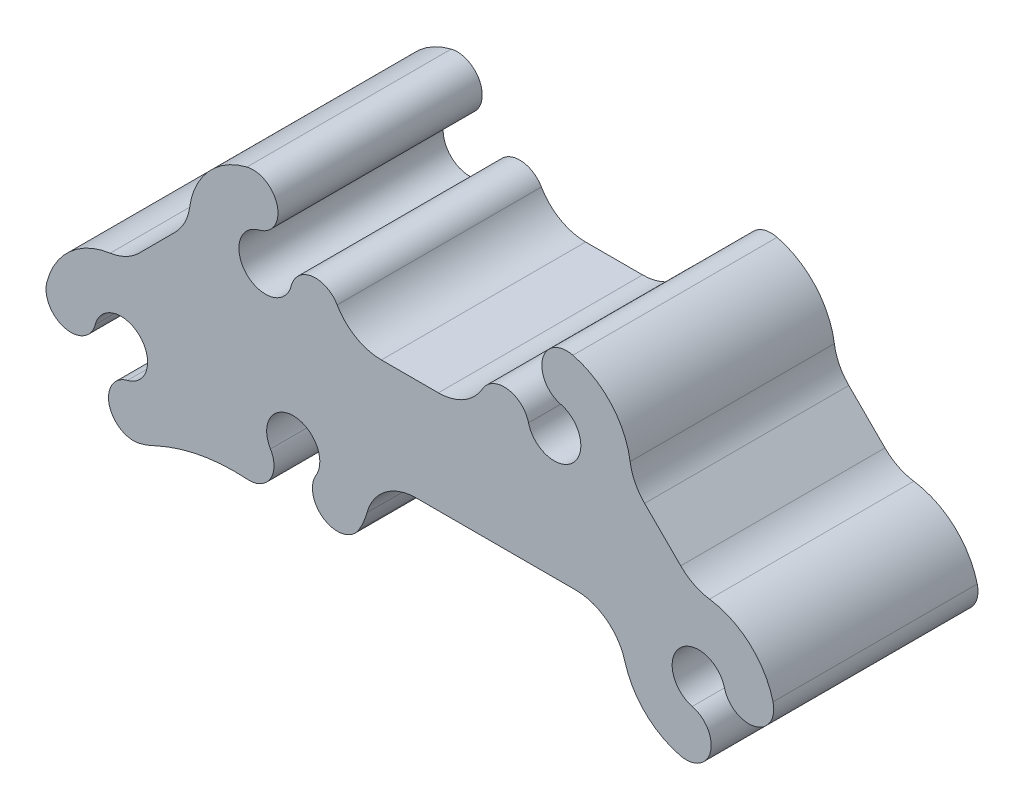
from build123d import *

# Parameters (mm, degrees)
BOSS_EXTRUDE1_DEPTH = 12.7


with BuildPart() as part:
    # Sketch1 → Boss-Extrude1 (new, symmetric)
    with BuildSketch(Plane.XY):
        with BuildLine():
            Line((3.541744722, 6.350000317), (-3.541744722, 6.350000317))
            ThreePointArc((-3.541744722, 6.350000317), (-6.717339471, 7.201082424), (-9.041692685, 9.526189926))
            ThreePointArc((-9.041692685, 9.526189926), (-12.168838665, 11.052363462), (-14.755482048, 8.724806019))
            ThreePointArc((-14.755482048, 8.724806019), (-20.272604103, 7.166406874), (-18.823535008, 12.713247635))
            ThreePointArc((-18.823535008, 12.713247635), (-16.4863366, 16.468880196), (-20.266433142, 18.766301026))
            ThreePointArc((-20.266433142, 18.766301026), (-25.058481671, 15.875940516), (-27.400098665, 10.793151634))
            ThreePointArc((-27.400098665, 10.793151634), (-28.012836895, 8.894644494), (-29.184374008, 7.27993762))
            Line((-29.184374008, 7.27993762), (-33.668197009, 2.789809368))
            ThreePointArc((-33.668197009, 2.789809368), (-35.320246571, 1.597881998), (-37.264713426, 0.990422317))
            ThreePointArc((-37.264713426, 0.990422317), (-42.296938103, -1.364178798), (-45.159399664, -6.125874443))
            ThreePointArc((-45.159399664, -6.125874443), (-42.896712959, -9.899879208), (-39.1227081, -7.637192526))
            ThreePointArc((-39.1227081, -7.637192526), (-33.584022437, -6.104926504), (-35.119498005, -11.642723169))
            ThreePointArc((-35.119498005, -11.642723169), (-37.384371438, -15.415416021), (-33.611678586, -17.680289454))
            ThreePointArc((-33.611678586, -17.680289454), (-32.609025986, -17.370294909), (-31.646563329, -16.951875875))
            ThreePointArc((-31.646563329, -16.951875875), (-26.066681379, -15.174096844), (-20.21993522, -14.840719891))
            ThreePointArc((-20.21993522, -14.840719891), (-17.353189866, -13.362481197), (-17.337180754, -10.137087846))
            ThreePointArc((-17.337180754, -10.137087846), (-14.434495922, -5.136768789), (-11.74460461, -10.254703395))
            ThreePointArc((-11.74460461, -10.254703395), (-10.54959622, -14.439704472), (-6.339625545, -13.335881127))
            ThreePointArc((-6.339625545, -13.335881127), (-5.758478435, -12.199696418), (-5.334434584, -10.996021018))
            ThreePointArc((-5.334434584, -10.996021018), (-3.058049309, -7.643184473), (0.782668949, -6.35))
            Line((0.782668949, -6.35), (20.629531136, -6.35))
            ThreePointArc((20.629531136, -6.35), (24.469498585, -7.642614313), (26.746128433, -10.994204727))
            ThreePointArc((26.746128433, -10.994204727), (29.278173872, -15.26179643), (33.613137194, -17.676684799))
            ThreePointArc((33.613137194, -17.676684799), (37.385829768, -15.411811583), (35.120956636, -11.639118675))
            ThreePointArc((35.120956636, -11.639118675), (33.586157492, -6.100645238), (39.124630957, -7.635444299))
            ThreePointArc((39.124630957, -7.635444299), (42.897323989, -9.900317715), (45.162197311, -6.127624707))
            ThreePointArc((45.162197311, -6.127624707), (42.301720517, -1.363571666), (37.269569316, 0.993541642))
            ThreePointArc((37.269569316, 0.993541642), (35.33100147, 1.598861028), (33.682682253, 2.785242337))
            Line((33.682682253, 2.785242337), (29.191501523, 7.268011131))
            ThreePointArc((29.191501523, 7.268011131), (27.998435311, 8.921281589), (27.390796294, 10.867427785))
            ThreePointArc((27.390796294, 10.867427785), (25.0373104, 15.90083737), (20.275755297, 18.764698607))
            ThreePointArc((20.275755297, 18.764698607), (16.501386803, 16.503215052), (18.762343911, 12.728531392))
            ThreePointArc((18.762343911, 12.728531392), (20.292630817, 7.189814806), (14.755356019, 8.725310571))
            ThreePointArc((14.755356019, 8.725310571), (12.168581157, 11.052399567), (9.041692685, 9.526189926))
            ThreePointArc((9.041692685, 9.526189926), (6.717339471, 7.201082424), (3.541744722, 6.350000317))
        make_face()
    extrude(amount=BOSS_EXTRUDE1_DEPTH, both=True)


solid = part.part
